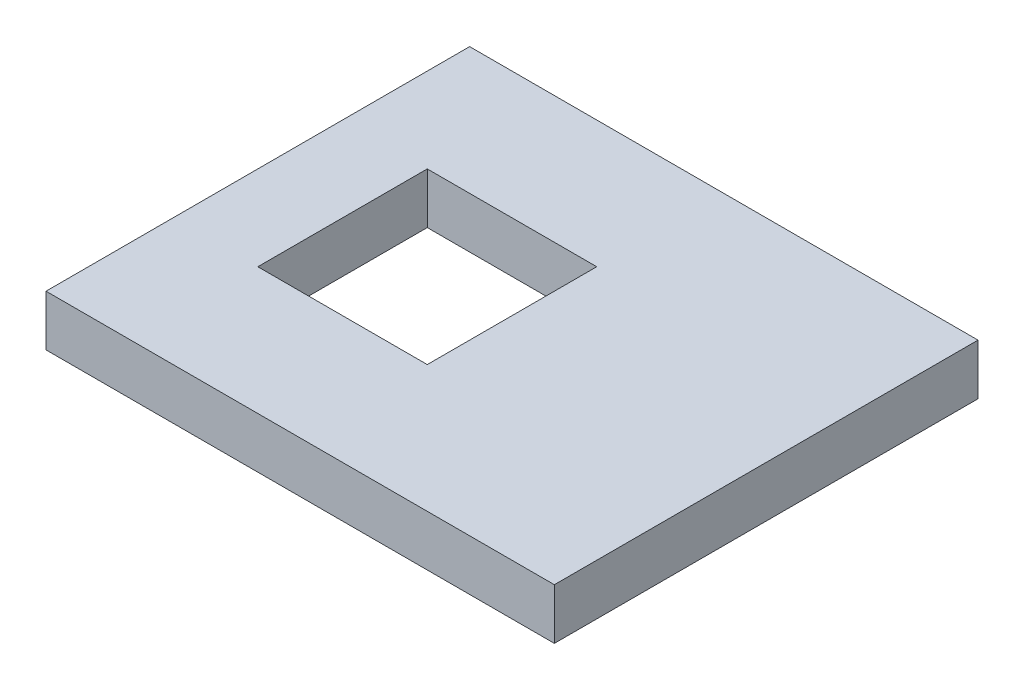
from build123d import *

# Parameters (mm, degrees)
SKETCH6_W           = 30
SKETCH6_H           = 25
BOSS_EXTRUDE6_DEPTH = 3
SKETCH8_W           = 10
SKETCH8_H           = 10
CUT_EXTRUDE1_DEPTH  = 21.453585836


with BuildPart() as part:
    # Sketch6 → Boss-Extrude6 (new body)
    with BuildSketch(Plane(origin=(0, 0, 0), x_dir=(1, 0, 0), z_dir=(0, 1, 0))):
        with Locations((-0.909090909, 0)):
            Rectangle(SKETCH6_W, SKETCH6_H)
    extrude(amount=BOSS_EXTRUDE6_DEPTH)

    # Sketch8 → Cut-Extrude1 (cut, through all)
    with BuildSketch(Plane(origin=(0, 3, 0), x_dir=(1, 0, 0), z_dir=(0, 1, 0))):
        with Locations((-5.909090909, 0)):
            Rectangle(SKETCH8_W, SKETCH8_H)
    extrude(amount=-CUT_EXTRUDE1_DEPTH, mode=Mode.SUBTRACT)


solid = part.part
